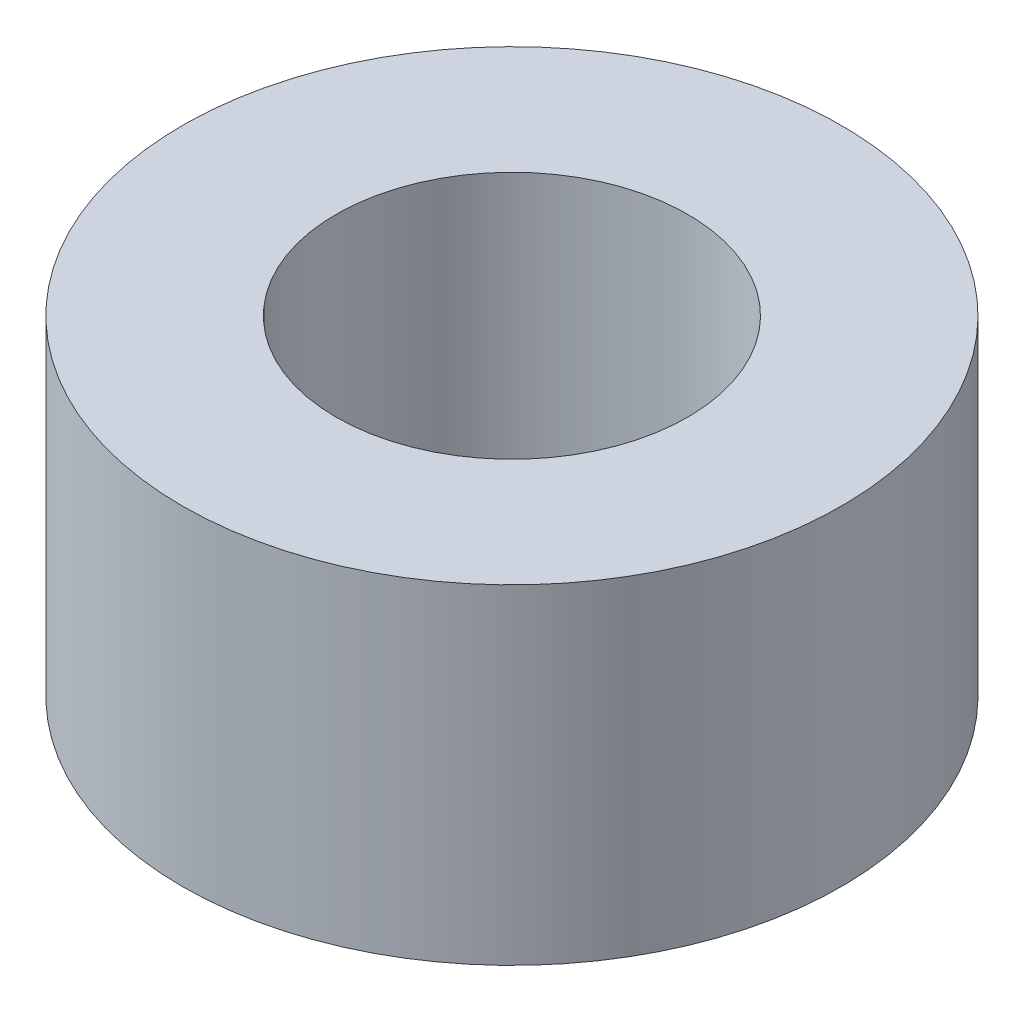
from build123d import *

# Parameters (mm, degrees)
SKETCH1_R           = 3
SKETCH1_R_2         = 1.6
BOSS_EXTRUDE1_DEPTH = 3


with BuildPart() as part:
    # Sketch1 → Boss-Extrude1 (new body)
    with BuildSketch(Plane(origin=(0, 0, 0), x_dir=(1, 0, 0), z_dir=(0, 1, 0))):
        with Locations(Location((0, 0, 0), (0, 0, 270))):
            Circle(SKETCH1_R)
        with Locations(Location((0, 0, 0), (0, 0, 270))):
            Circle(SKETCH1_R_2, mode=Mode.SUBTRACT)
    extrude(amount=BOSS_EXTRUDE1_DEPTH)


solid = part.part
